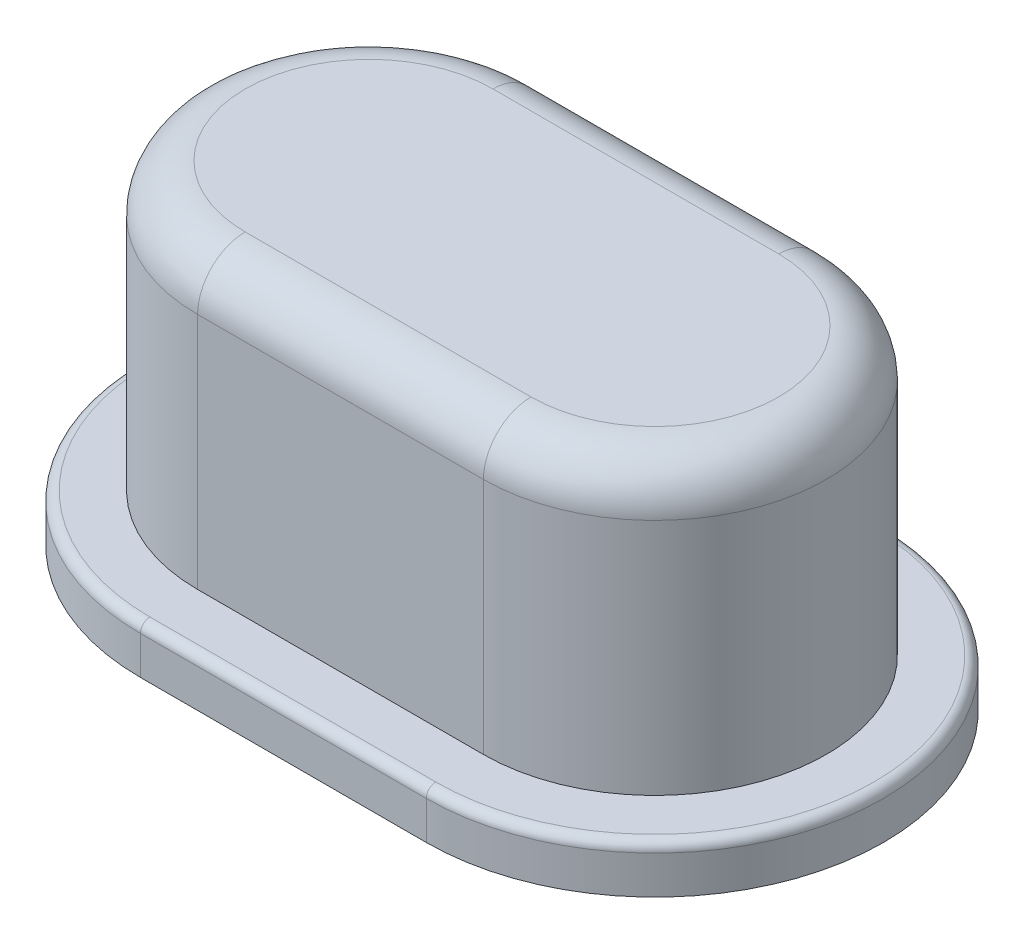
from build123d import *

# Parameters (mm, degrees)
BOSS_EXTRUDE1_DEPTH = 3
BOSS_EXTRUDE2_START = 0.5
BOSS_EXTRUDE2_DEPTH = 0.5
FILLET1_R           = 0.5
FILLET2_R           = 0.1


with BuildPart() as part:
    # Sketch1 → Boss-Extrude1 (new body)
    with BuildSketch(Plane(origin=(0, 0, 0), x_dir=(1, 0, 0), z_dir=(0, 1, 0))):
        with BuildLine():
            Line((-1.5, 1.8), (1.5, 1.8))
            ThreePointArc((1.5, 1.8), (3.3, 0), (1.5, -1.8))
            Line((1.5, -1.8), (-1.5, -1.8))
            ThreePointArc((-1.5, -1.8), (-3.3, 0), (-1.5, 1.8))
        make_face()
    extrude(amount=BOSS_EXTRUDE1_DEPTH)

    # Sketch2 → Boss-Extrude2 (add)
    # profile 1 of 2: a face of its own
    with BuildSketch(Plane.XZ.offset(BOSS_EXTRUDE2_START)):
        with BuildLine():
            Line((-1.5, -2.4), (1.5, -2.4))
            ThreePointArc((1.5, -2.4), (3.9, 0), (1.5, 2.4))
            Line((1.5, 2.4), (-1.5, 2.4))
            ThreePointArc((-1.5, 2.4), (-3.9, 0), (-1.5, -2.4))
        make_face()
        with BuildLine():
            ThreePointArc((-1.5, 1.8), (-3.3, 0), (-1.5, -1.8))
            Line((-1.5, -1.8), (1.5, -1.8))
            ThreePointArc((1.5, -1.8), (3.3, 0), (1.5, 1.8))
            Line((1.5, 1.8), (-1.5, 1.8))
        make_face(mode=Mode.SUBTRACT)
    # profile 2 of 2: a face of its own
    with BuildSketch(Plane.XZ.offset(BOSS_EXTRUDE2_START)):
        with BuildLine():
            Line((1.5, 1.8), (-1.5, 1.8))
            ThreePointArc((-1.5, 1.8), (-3.3, 0), (-1.5, -1.8))
            Line((-1.5, -1.8), (1.5, -1.8))
            ThreePointArc((1.5, -1.8), (3.3, 0), (1.5, 1.8))
        make_face()
    extrude(amount=-BOSS_EXTRUDE2_DEPTH)

    # Fillet1
    fillet1_edges = [part.edges().sort_by_distance(p)[0] for p in [
        (3.3, 3, 0),
        (0, 3, -1.8),
        (-3.3, 3, 0),
        (0, 3, 1.8),
    ]]
    fillet(fillet1_edges, radius=FILLET1_R)

    # Fillet2
    fillet2_edges = [part.edges().sort_by_distance(p)[0] for p in [
        (0, 0, -2.4),
        (3.9, 0, 0),
        (0, 0, 2.4),
        (-3.9, 0, 0),
    ]]
    fillet(fillet2_edges, radius=FILLET2_R)


solid = part.part
